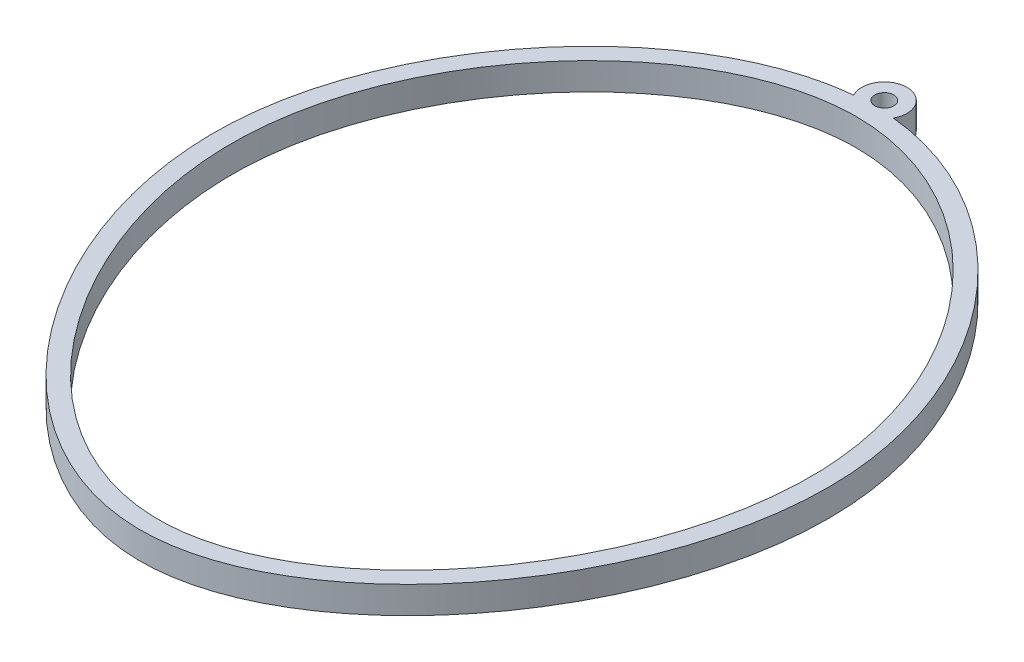
from build123d import *

# Parameters (mm, degrees)
SKETCH1_R           = 1.05
BOSS_EXTRUDE1_DEPTH = 3


with BuildPart() as part:
    # Sketch1 → Boss-Extrude1 (new body)
    # profile 1 of 2: a face of its own
    with BuildSketch(Plane(origin=(0, 0, 0), x_dir=(1, 0, 0), z_dir=(0, 1, 0))):
        with BuildLine():
            add(Edge.make_bspline(
                [(0, 36.74405), (0.730717393, 36.74405), (1.461434786, 36.708792733), (2.190800135, 36.639726634)],
                knots=[0, 0, 0, 0, 0.010545803, 0.010545803, 0.010545803, 0.010545803], degree=3))
            ThreePointArc((2.190800135, 36.639726634), (0, 40.34405), (-2.190800135, 36.639726634))
            add(Edge.make_bspline(
                [(-2.190800135, 36.639726634), (-1.461434786, 36.708792733), (-0.730717393, 36.74405), (0, 36.74405)],
                knots=[0.989454197, 0.989454197, 0.989454197, 0.989454197, 1, 1, 1, 1], degree=3))
        make_face()
        with Locations(Location((0, 37.84405, 0), (0, 0, 270))):
            Circle(SKETCH1_R, mode=Mode.SUBTRACT)
    # profile 2 of 2: a face of its own
    with BuildSketch(Plane(origin=(0, 0, 0), x_dir=(1, 0, 0), z_dir=(0, 1, 0))):
        with BuildLine():
            add(Edge.make_bspline(
                [(0, 36.74405), (16.354237743, 36.74405), (50.999177464, -0.668721052), (0, -67.587050309), (-50.999177464, -0.668721052), (-16.354237743, 36.74405), (0, 36.74405)],
                knots=[0, 0, 0, 0, 0.236026356, 0.5, 0.763973644, 1, 1, 1, 1], degree=3))
        make_face()
        with BuildLine():
            add(Edge.make_bspline(
                [(0, 34.74405), (15.357403663, 34.74405), (48.007482795, -0.70488126), (0, -64.582608992), (-48.007482795, -0.70488126), (-15.357403663, 34.74405), (0, 34.74405)],
                knots=[0, 0, 0, 0, 0.235181722, 0.5, 0.764818278, 1, 1, 1, 1], degree=3))
        make_face(mode=Mode.SUBTRACT)
    extrude(amount=BOSS_EXTRUDE1_DEPTH)


solid = part.part
